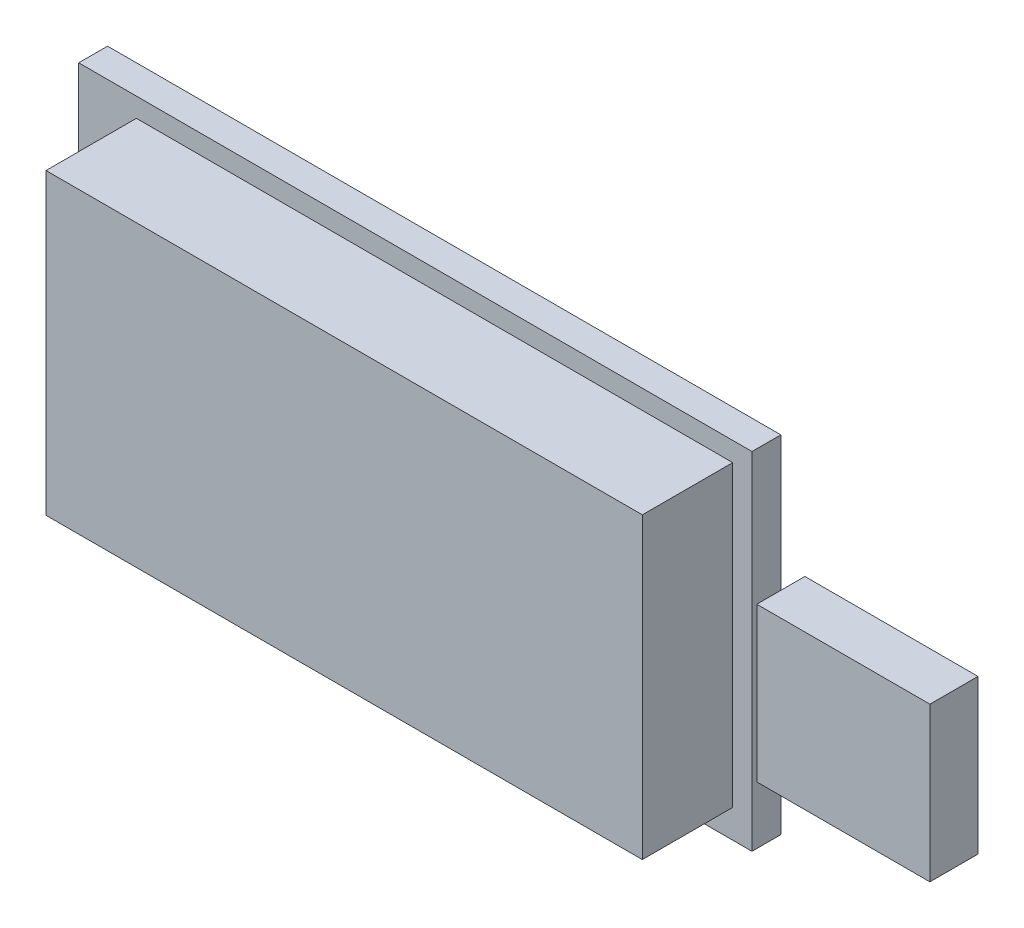
from build123d import *

# Parameters (mm, degrees)
RESSALTO_EXTRUS_O1_DEPTH = 1.5
RESSALTO_EXTRUS_O2_DEPTH = 6.2
ESBO_O1_4_W              = 9
ESBO_O1_4_H              = 8
RESSALTO_EXTRUS_O3_DEPTH = 1.25


with BuildPart() as part:
    # Esboço1 → Ressalto-extrusão1 (new body)
    with BuildSketch(Plane.XY):
        Polygon((0, 18), (0, 0), (35, 0), (35, 3), (35, 11), (35, 18), align=None)
        Polygon((34, 17), (34, 9), (34, 1.477317564), (3, 1.477317564), (3, 17), align=None, mode=Mode.SUBTRACT)
    extrude(amount=RESSALTO_EXTRUS_O1_DEPTH)

    # Esboço1<3> → Ressalto-extrusão2 (add)
    with BuildSketch(Plane.XY):
        Polygon((34, 1.477317564), (34, 9), (34, 17), (3, 17), (3, 1.477317564), align=None)
    extrude(amount=RESSALTO_EXTRUS_O2_DEPTH)

    # Esboço1<4> → Ressalto-extrusão3 (add, symmetric)
    with BuildSketch(Plane.XY):
        with Locations((39.5, 7)):
            Rectangle(ESBO_O1_4_W, ESBO_O1_4_H)
    extrude(amount=RESSALTO_EXTRUS_O3_DEPTH, both=True)


solid = part.part
